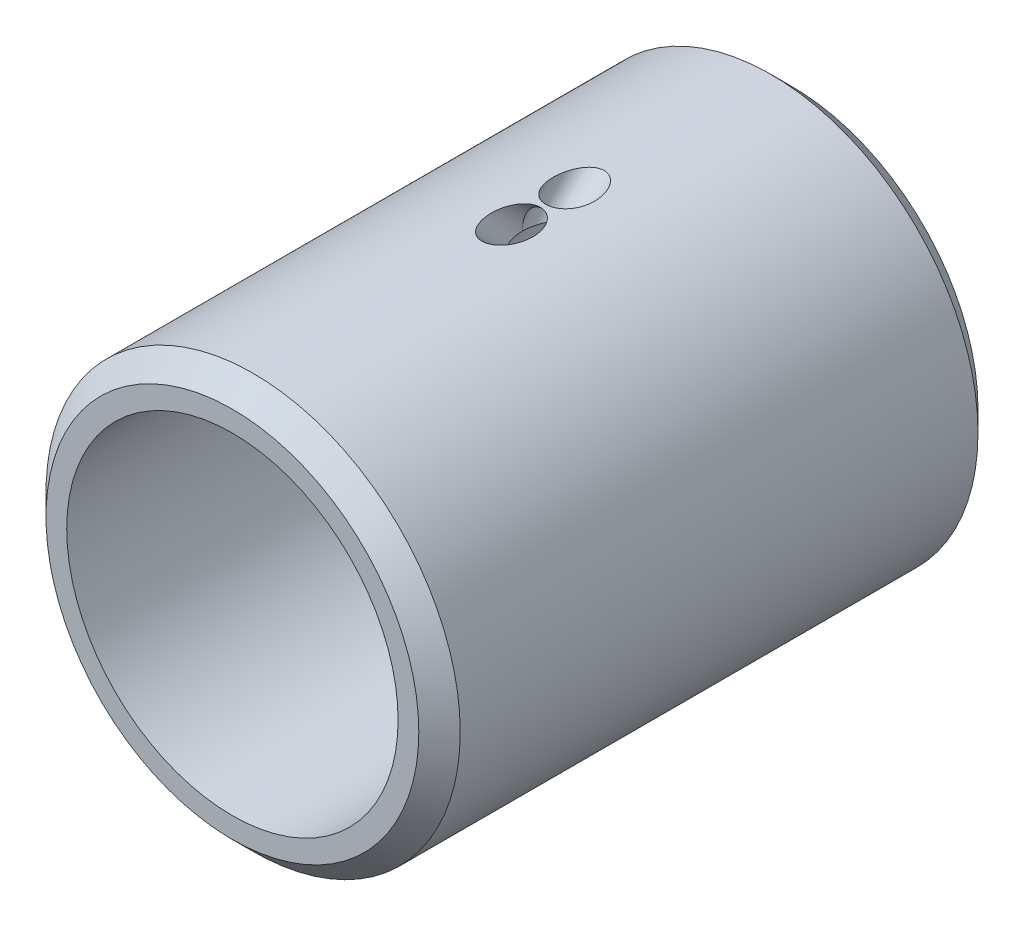
from build123d import *

# Parameters (mm, degrees)
SKETCH_1_R          = 10
SKETCH_1_R_2        = 8
EXTRUDE_1_DEPTH     = 13.5
CHAMFER_1_SIZE      = 1
CUT_EXTRUDE_START   = -10
SKETCH_2_R          = 8.5
CUT_EXTRUDE_1_DEPTH = 4
SWEEP_1_PROFILE_R   = 1


with BuildPart() as part:
    # 草图1 → 凸台-拉伸1 (new, symmetric)
    with BuildSketch(Plane.XY):
        Circle(SKETCH_1_R)
        Circle(SKETCH_1_R_2, mode=Mode.SUBTRACT)
    extrude(amount=EXTRUDE_1_DEPTH, both=True)

    # 倒角1
    chamfer_1_edges = [part.edges().sort_by_distance(p)[0] for p in [
        (-10, 0, -13.5),
        (-10, 0, 13.5),
    ]]
    chamfer(chamfer_1_edges, length=CHAMFER_1_SIZE)

    # 草图2 → 切除-拉伸1 (cut)
    with BuildSketch(Plane(origin=(0, 0, -13.5), x_dir=(-1, 0, 0), z_dir=(0, 0, -1)).offset(CUT_EXTRUDE_START)):
        Circle(SKETCH_2_R)
    extrude(amount=-CUT_EXTRUDE_1_DEPTH, mode=Mode.SUBTRACT)

    # 切除-扫描1: sweep along a path in 草图3
    with BuildLine(Plane(origin=(0, 0, 0), x_dir=(0, 0, -1), z_dir=(1, 0, 0))) as sweep_1_path:
        Line((5.960249648, 12.918859865), (1.5, 8.458610217))
        Line((1.5, 8.458610217), (-2.960249648, 12.918859865))
    # 切除-扫描1 profile (on start of the path) → 切除-扫描1 (sweep, cut)
    with BuildSketch(Plane(origin=(0, 12.918859865, -5.960249648), x_dir=(0, 0.7071067811865478, 0.7071067811865472), z_dir=(0, -0.7071067811865472, 0.7071067811865478))):
        Circle(SWEEP_1_PROFILE_R)
    sweep(path=sweep_1_path.line, transition=Transition.RIGHT, mode=Mode.SUBTRACT)


solid = part.part
